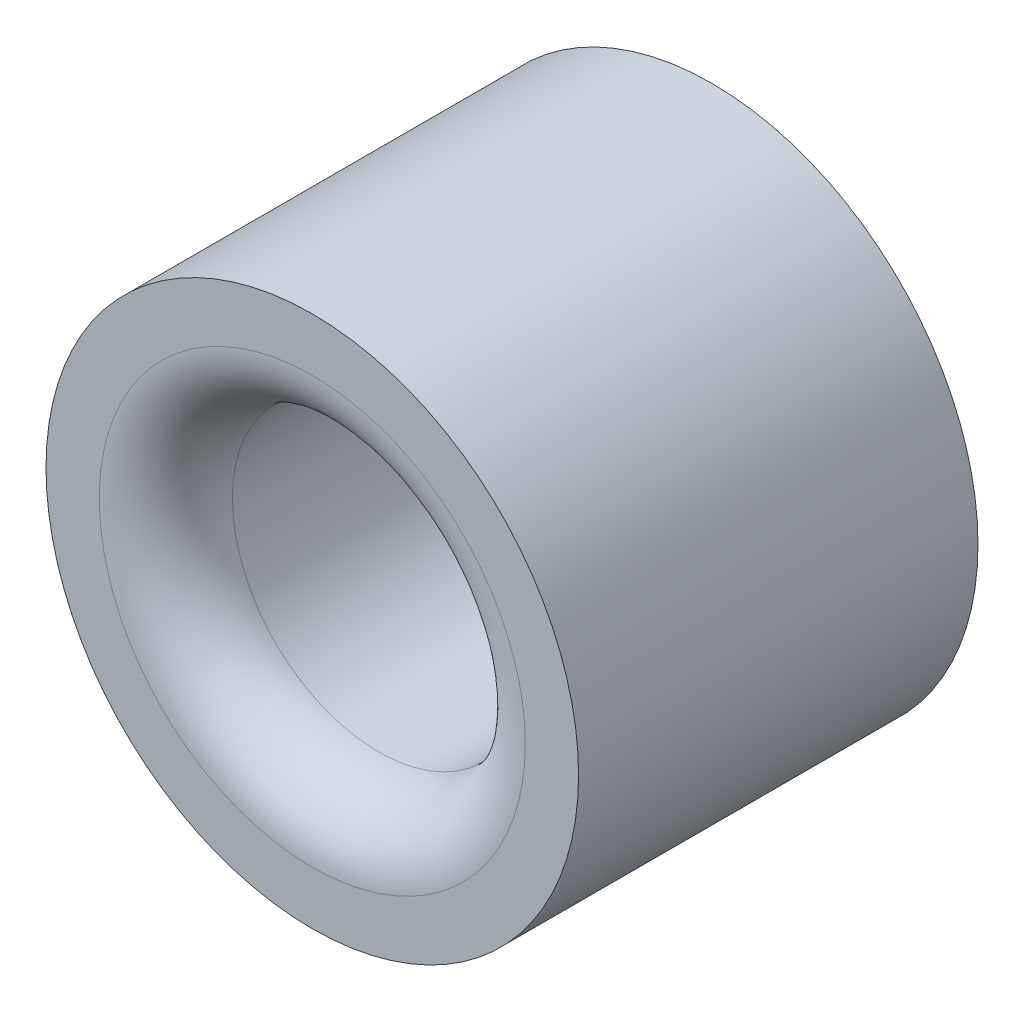
from build123d import *

# Parameters (mm, degrees)
SKETCH_1_R      = 2
SKETCH_1_R_2    = 1.1
EXTRUDE_1_DEPTH = 3
FILLET_1_R      = 0.5


with BuildPart() as part:
    # 草图1 → 凸台-拉伸1 (new body)
    with BuildSketch(Plane.XY):
        Circle(SKETCH_1_R)
        Circle(SKETCH_1_R_2, mode=Mode.SUBTRACT)
    extrude(amount=EXTRUDE_1_DEPTH)

    # 圆角1
    fillet_1_edges = [part.edges().sort_by_distance(p)[0] for p in [
        (-1.1, 0, 0),
        (-1.1, 0, 3),
    ]]
    fillet(fillet_1_edges, radius=FILLET_1_R)


solid = part.part
